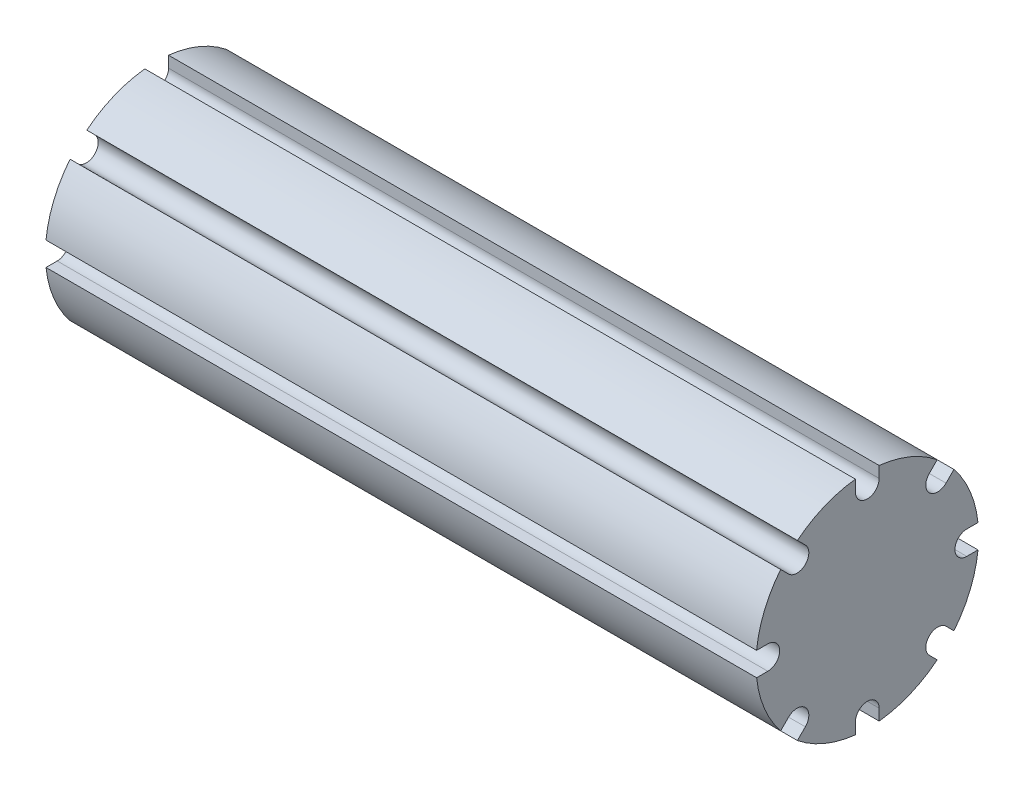
from build123d import *

# Parameters (mm, degrees)
SKETCH_1_R               = 23.5
EXTRUDE_1_DEPTH          = 75
CUT_EXTRUDE_1_DEPTH      = 154.637560512
PATTERN_CIRCULAR_2_COUNT = 8


with BuildPart() as part:
    # 草图1 → 凸台-拉伸1 (new, symmetric)
    with BuildSketch(Plane(origin=(0, 0, 0), x_dir=(0, 0, -1), z_dir=(1, 0, 0))):
        Circle(SKETCH_1_R)
    extrude(amount=EXTRUDE_1_DEPTH, both=True)

    # 草图2 → 切除-拉伸1 (cut, through all)
    with BuildSketch(Plane(origin=(75, 0, 0), x_dir=(0, 0, -1), z_dir=(1, 0, 0))):
        with BuildLine():
            ThreePointArc((-2.5, 21), (0, 18.5), (2.5, 21))
            ThreePointArc((2.5, 21), (1.767766953, 22.767766953), (0, 23.5))
            ThreePointArc((0, 23.5), (-1.251777149, 23.46663704), (-2.5, 23.366642891))
            Line((-2.5, 23.366642891), (-2.5, 21))
        make_face()
        with BuildLine():
            ThreePointArc((0, 23.5), (1.767766953, 22.767766953), (2.5, 21))
            Line((2.5, 21), (2.5, 23.366642891))
            ThreePointArc((2.5, 23.366642891), (1.251777149, 23.46663704), (0, 23.5))
        make_face()
    cut_extrude_1 = extrude(amount=-CUT_EXTRUDE_1_DEPTH, mode=Mode.SUBTRACT)

    # 阵列(圆周)2: 切除-拉伸1 ×8 about axis
    pattern_circular_2_axis = Axis((0, 0, 0), (1, 0, 0))
    for i in range(1, PATTERN_CIRCULAR_2_COUNT):
        add(cut_extrude_1.rotate(pattern_circular_2_axis, i * 360 / PATTERN_CIRCULAR_2_COUNT), mode=Mode.SUBTRACT)


solid = part.part
